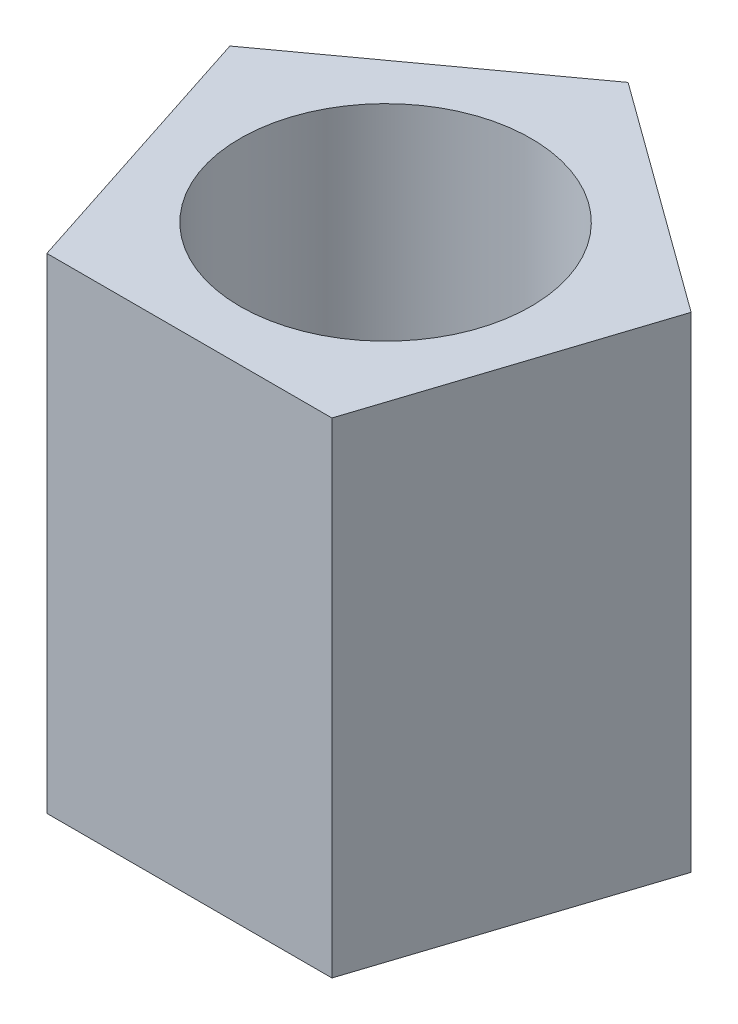
from build123d import *

# Parameters (mm, degrees)
BOSS_EXTRUDE1_DEPTH = 12.7
CIRPATTERN1_COUNT   = 5
SKETCH3_R           = 3.81
CUT_EXTRUDE1_DEPTH  = 16.42998846


with BuildPart() as part:
    # Sketch1 → Boss-Extrude1 (new body)
    with BuildSketch(Plane(origin=(0, 0, 0), x_dir=(1, 0, 0), z_dir=(0, 1, 0))):
        Polygon((0, 6.35), (6.039208878, 1.962257914), (0, 0), align=None)
    boss_extrude1 = extrude(amount=BOSS_EXTRUDE1_DEPTH)

    # CirPattern1: Boss-Extrude1 ×5 about axis
    cirpattern1_axis = Axis((0, 0, 0), (0, 1, 0))
    for i in range(1, CIRPATTERN1_COUNT):
        add(boss_extrude1.rotate(cirpattern1_axis, i * 360 / CIRPATTERN1_COUNT))

    # Sketch3 → Cut-Extrude1 (cut, through all)
    with BuildSketch(Plane(origin=(0, 12.7, 0), x_dir=(1, 0, 0), z_dir=(0, 1, 0))):
        with Locations(Location((0, 0, 0), (0, 0, 270))):
            Circle(SKETCH3_R)
    extrude(amount=-CUT_EXTRUDE1_DEPTH, mode=Mode.SUBTRACT)


solid = part.part
